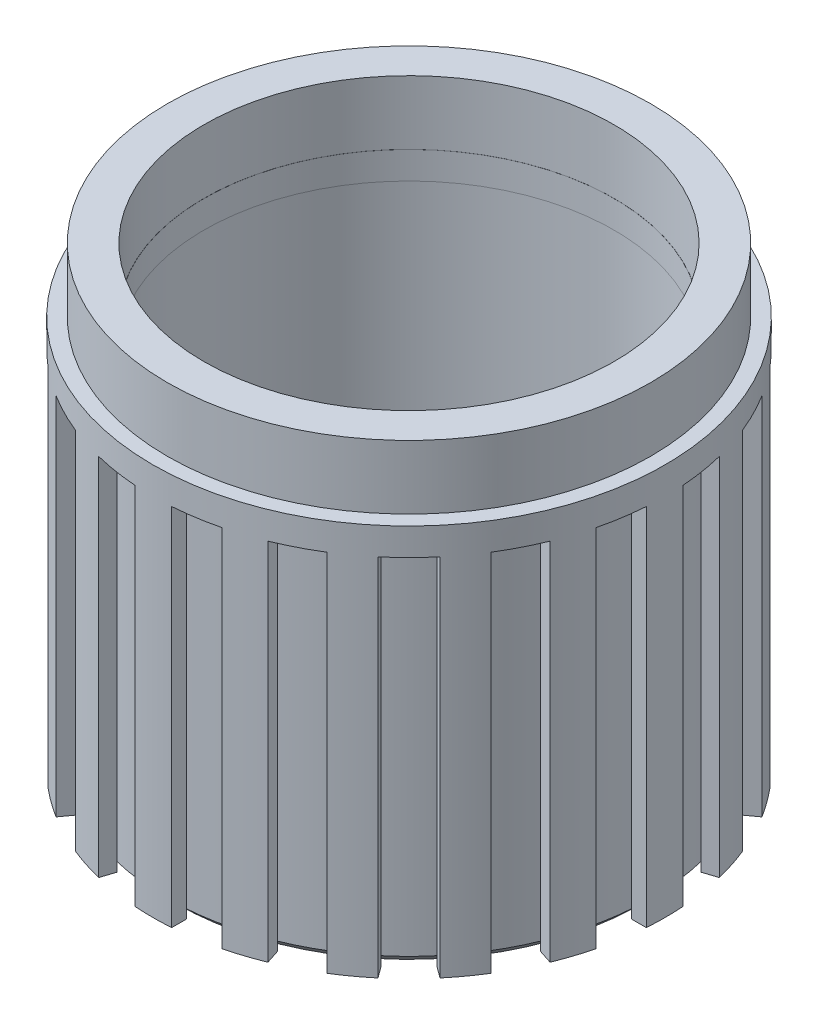
from build123d import *
from build123d.topology import SkipClean

# Parameters (mm, degrees)
SKETCH_1_R      = 13.25
EXTRUDE_1_DEPTH = 25
SHELL_1_T       = -2
CHAMFER_1_SIZE  = 0.5
EXTRUDE_2_DEPTH = 20
SKETCH_3_R      = 14.05
SKETCH_3_R_2    = 11.244970287
EXTRUDE_3_DEPTH = 1.5


with BuildPart() as part:
    # 草图1 → 拉伸1 (new body)
    with BuildSketch(Plane(origin=(0, 0, 0), x_dir=(1, 0, 0), z_dir=(0, 1, 0))):
        with Locations(Location((0, 0, 0), (0, 0, 270))):
            Circle(SKETCH_1_R)
    extrude(amount=EXTRUDE_1_DEPTH)

    # 抽壳1
    shell_1_openings = [part.faces().sort_by_distance(p)[0] for p in [
        (0, 25, 0),
    ]]
    offset(amount=SHELL_1_T, openings=shell_1_openings, kind=Kind.INTERSECTION)

    # 倒角1
    chamfer_1_edges = [part.edges().sort_by_distance(p)[0] for p in [
        (0, 0, -13.25),
    ]]
    chamfer(chamfer_1_edges, length=CHAMFER_1_SIZE)

    # 草图2 → 拉伸2 (add)
    with BuildSketch(Plane.XZ):
        with BuildLine():
            Line((5.03385402, 12.25654167), (5.281734279, 13.01943866))
            ThreePointArc((5.281734279, 13.01943866), (4.341688771, 13.362344054), (3.379621246, 13.637472648))
            Line((3.379621246, 13.637472648), (3.131740988, 12.874575658))
            ThreePointArc((3.131740988, 12.874575658), (4.094475175, 12.601498841), (5.03385402, 12.25654167))
        make_face()
        with BuildLine():
            Line((1, 13.212210262), (1, 14.014367628))
            ThreePointArc((1, 14.014367628), (0, 14.05), (-1, 14.014367628))
            Line((-1, 14.014367628), (-1, 13.212210262))
            ThreePointArc((-1, 13.212210262), (0, 13.25), (1, 13.212210262))
        make_face()
        with BuildLine():
            Line((8.574959336, 10.101117383), (9.046455606, 10.750076324))
            ThreePointArc((9.046455606, 10.750076324), (8.258382795, 11.366688771), (7.428421617, 11.925646828))
            Line((7.428421617, 11.925646828), (6.956925348, 11.276687887))
            ThreePointArc((6.956925348, 11.276687887), (7.788154593, 10.719475175), (8.574959336, 10.101117383))
        make_face()
        with BuildLine():
            Line((11.276687887, 6.956925348), (11.925646828, 7.428421617))
            ThreePointArc((11.925646828, 7.428421617), (11.366688771, 8.258382795), (10.750076324, 9.046455606))
            Line((10.750076324, 9.046455606), (10.101117383, 8.574959336))
            ThreePointArc((10.101117383, 8.574959336), (10.719475175, 7.788154593), (11.276687887, 6.956925348))
        make_face()
        with BuildLine():
            Line((12.874575658, 3.131740988), (13.637472648, 3.379621246))
            ThreePointArc((13.637472648, 3.379621246), (13.362344054, 4.341688771), (13.01943866, 5.281734279))
            Line((13.01943866, 5.281734279), (12.25654167, 5.03385402))
            ThreePointArc((12.25654167, 5.03385402), (12.601498841, 4.094475175), (12.874575658, 3.131740988))
        make_face()
        with BuildLine():
            Line((13.212210262, -1), (14.014367628, -1))
            ThreePointArc((14.014367628, -1), (14.05, 0), (14.014367628, 1))
            Line((14.014367628, 1), (13.212210262, 1))
            ThreePointArc((13.212210262, 1), (13.25, 0), (13.212210262, -1))
        make_face()
        with BuildLine():
            Line((12.25654167, -5.03385402), (13.01943866, -5.281734279))
            ThreePointArc((13.01943866, -5.281734279), (13.362344054, -4.341688771), (13.637472648, -3.379621246))
            Line((13.637472648, -3.379621246), (12.874575658, -3.131740988))
            ThreePointArc((12.874575658, -3.131740988), (12.601498841, -4.094475175), (12.25654167, -5.03385402))
        make_face()
        with BuildLine():
            Line((10.101117383, -8.574959336), (10.750076324, -9.046455606))
            ThreePointArc((10.750076324, -9.046455606), (11.366688771, -8.258382795), (11.925646828, -7.428421617))
            Line((11.925646828, -7.428421617), (11.276687887, -6.956925348))
            ThreePointArc((11.276687887, -6.956925348), (10.719475175, -7.788154593), (10.101117383, -8.574959336))
        make_face()
        with BuildLine():
            Line((6.956925348, -11.276687887), (7.428421617, -11.925646828))
            ThreePointArc((7.428421617, -11.925646828), (8.258382795, -11.366688771), (9.046455606, -10.750076324))
            Line((9.046455606, -10.750076324), (8.574959336, -10.101117383))
            ThreePointArc((8.574959336, -10.101117383), (7.788154593, -10.719475175), (6.956925348, -11.276687887))
        make_face()
        with BuildLine():
            Line((3.131740988, -12.874575658), (3.379621246, -13.637472648))
            ThreePointArc((3.379621246, -13.637472648), (4.341688771, -13.362344054), (5.281734279, -13.01943866))
            Line((5.281734279, -13.01943866), (5.03385402, -12.25654167))
            ThreePointArc((5.03385402, -12.25654167), (4.094475175, -12.601498841), (3.131740988, -12.874575658))
        make_face()
        with BuildLine():
            Line((-1, -13.212210262), (-1, -14.014367628))
            ThreePointArc((-1, -14.014367628), (0, -14.05), (1, -14.014367628))
            Line((1, -14.014367628), (1, -13.212210262))
            ThreePointArc((1, -13.212210262), (0, -13.25), (-1, -13.212210262))
        make_face()
        with BuildLine():
            Line((-5.03385402, -12.25654167), (-5.281734279, -13.01943866))
            ThreePointArc((-5.281734279, -13.01943866), (-4.341688771, -13.362344054), (-3.379621246, -13.637472648))
            Line((-3.379621246, -13.637472648), (-3.131740988, -12.874575658))
            ThreePointArc((-3.131740988, -12.874575658), (-4.094475175, -12.601498841), (-5.03385402, -12.25654167))
        make_face()
        with BuildLine():
            Line((-8.574959336, -10.101117383), (-9.046455606, -10.750076324))
            ThreePointArc((-9.046455606, -10.750076324), (-8.258382795, -11.366688771), (-7.428421617, -11.925646828))
            Line((-7.428421617, -11.925646828), (-6.956925348, -11.276687887))
            ThreePointArc((-6.956925348, -11.276687887), (-7.788154593, -10.719475175), (-8.574959336, -10.101117383))
        make_face()
        with BuildLine():
            Line((-11.276687887, -6.956925348), (-11.925646828, -7.428421617))
            ThreePointArc((-11.925646828, -7.428421617), (-11.366688771, -8.258382795), (-10.750076324, -9.046455606))
            Line((-10.750076324, -9.046455606), (-10.101117383, -8.574959336))
            ThreePointArc((-10.101117383, -8.574959336), (-10.719475175, -7.788154593), (-11.276687887, -6.956925348))
        make_face()
        with BuildLine():
            Line((-12.874575658, -3.131740988), (-13.637472648, -3.379621246))
            ThreePointArc((-13.637472648, -3.379621246), (-13.362344054, -4.341688771), (-13.01943866, -5.281734279))
            Line((-13.01943866, -5.281734279), (-12.25654167, -5.03385402))
            ThreePointArc((-12.25654167, -5.03385402), (-12.601498841, -4.094475175), (-12.874575658, -3.131740988))
        make_face()
        with BuildLine():
            Line((-13.212210262, 1), (-14.014367628, 1))
            ThreePointArc((-14.014367628, 1), (-14.05, 0), (-14.014367628, -1))
            Line((-14.014367628, -1), (-13.212210262, -1))
            ThreePointArc((-13.212210262, -1), (-13.25, 0), (-13.212210262, 1))
        make_face()
        with BuildLine():
            Line((-12.25654167, 5.03385402), (-13.01943866, 5.281734279))
            ThreePointArc((-13.01943866, 5.281734279), (-13.362344054, 4.341688771), (-13.637472648, 3.379621246))
            Line((-13.637472648, 3.379621246), (-12.874575658, 3.131740988))
            ThreePointArc((-12.874575658, 3.131740988), (-12.601498841, 4.094475175), (-12.25654167, 5.03385402))
        make_face()
        with BuildLine():
            Line((-10.101117383, 8.574959336), (-10.750076324, 9.046455606))
            ThreePointArc((-10.750076324, 9.046455606), (-11.366688771, 8.258382795), (-11.925646828, 7.428421617))
            Line((-11.925646828, 7.428421617), (-11.276687887, 6.956925348))
            ThreePointArc((-11.276687887, 6.956925348), (-10.719475175, 7.788154593), (-10.101117383, 8.574959336))
        make_face()
        with BuildLine():
            Line((-6.956925348, 11.276687887), (-7.428421617, 11.925646828))
            ThreePointArc((-7.428421617, 11.925646828), (-8.258382795, 11.366688771), (-9.046455606, 10.750076324))
            Line((-9.046455606, 10.750076324), (-8.574959336, 10.101117383))
            ThreePointArc((-8.574959336, 10.101117383), (-7.788154593, 10.719475175), (-6.956925348, 11.276687887))
        make_face()
        with BuildLine():
            Line((-3.131740988, 12.874575658), (-3.379621246, 13.637472648))
            ThreePointArc((-3.379621246, 13.637472648), (-4.341688771, 13.362344054), (-5.281734279, 13.01943866))
            Line((-5.281734279, 13.01943866), (-5.03385402, 12.25654167))
            ThreePointArc((-5.03385402, 12.25654167), (-4.094475175, 12.601498841), (-3.131740988, 12.874575658))
        make_face()
    extrude(amount=-EXTRUDE_2_DEPTH)

    # 草图3 → 拉伸3 (add)
    with SkipClean():  # the faces are left unmerged after this step: merging them gives an invalid solid
        with BuildSketch(Plane(origin=(0, 20, 0), x_dir=(1, 0, 0), z_dir=(0, 1, 0))):
            with Locations(Location((0, 0, 0), (0, 0, 85.91855766))):
                Circle(SKETCH_3_R)
            with Locations(Location((0, 0, 0), (0, 0, 270))):
                Circle(SKETCH_3_R_2, mode=Mode.SUBTRACT)
        extrude(amount=EXTRUDE_3_DEPTH)


solid = part.part
